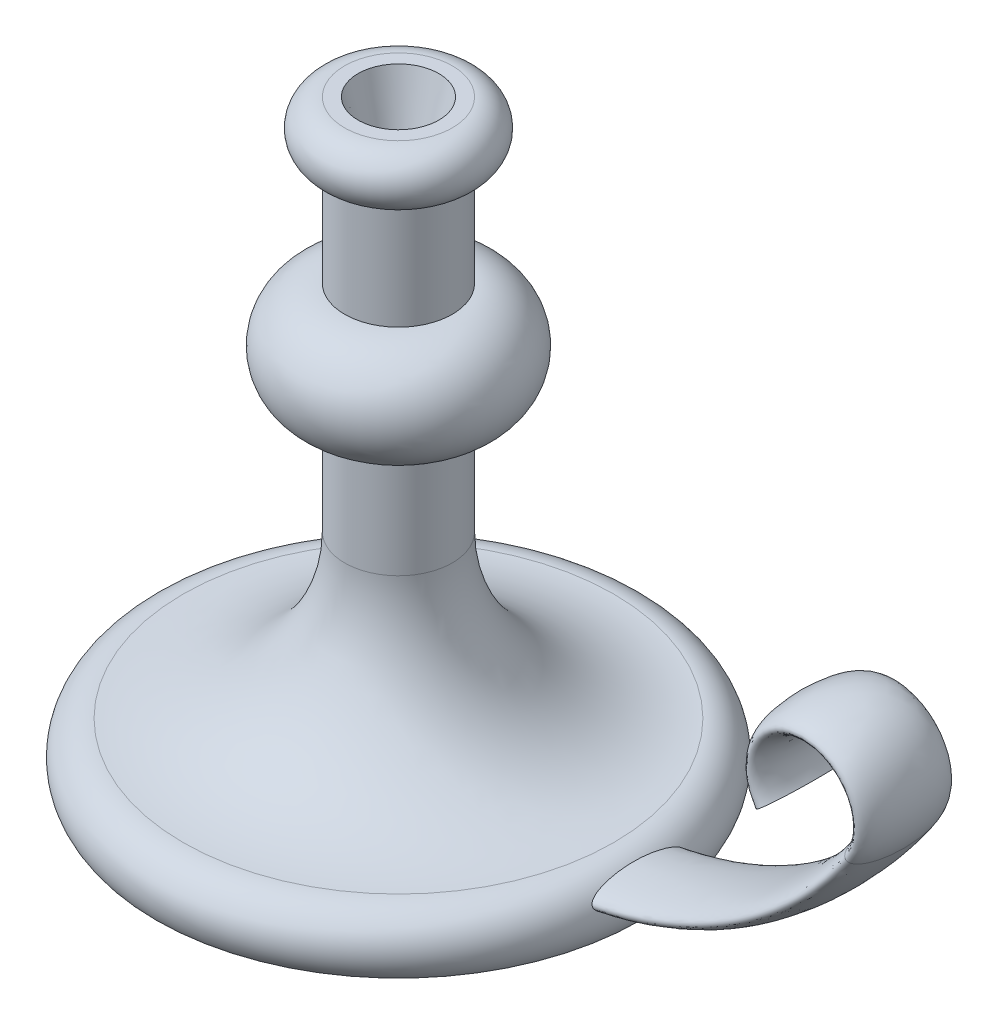
from build123d import *

# Parameters (mm, degrees)
SKETCH5_R          = 15
CUT_EXTRUDE1_DEPTH = 25
CUT_EXTRUDE1_DRAFT = -15
SKETCH7_RX         = 17.5
SKETCH7_RY         = 5


with BuildPart() as part:
    # Sketch1 → Revolve1 (revolve)
    with BuildSketch(Plane.XY, mode=Mode.PRIVATE) as revolve1_sk:
        with BuildLine():
            Line((0, 220), (0, 0))
            Line((0, 0), (90, 0))
            ThreePointArc((90, 0), (91.180339887, 13.090169944), (80, 20))
            ThreePointArc((80, 20), (37.573593129, 37.573593129), (20, 80))
            Line((20, 80), (20, 120))
            ThreePointArc((20, 120), (40, 140), (20, 160))
            Line((20, 160), (20, 200))
            ThreePointArc((20, 200), (30, 210), (20, 220))
            Line((20, 220), (0, 220))
        make_face()
    revolve(revolve1_sk.sketch.rotate(Axis((0, 220, 0), (0, -1, 0)), 180), axis=Axis((0, 220, 0), (0, -1, 0)))


with BuildPart() as cut_extrude1_tool:
    # Sketch5 → Cut-Extrude1 (with draft: the straight prism first)
    with BuildSketch(Plane(origin=(0, 220, 0), x_dir=(1, 0, 0), z_dir=(0, 1, 0))):
        Circle(SKETCH5_R)
    extrude(amount=-CUT_EXTRUDE1_DEPTH)
    # Cut-Extrude1: the draft: its side faces are tilted about the plane it starts from
    cut_extrude1_sides = [cut_extrude1_tool.faces().sort_by_distance(p)[0] for p in [
        (-15, 207.5, 0),
    ]]
    draft(cut_extrude1_sides, Plane(origin=(0, 220, 0), x_dir=(1, 0, 0), z_dir=(0, 1, 0)), CUT_EXTRUDE1_DRAFT)


with BuildPart() as part_1:
    add(part.part)

    # Cut-Extrude1: cut by cut_extrude1_tool
    add(cut_extrude1_tool.part, mode=Mode.SUBTRACT)

    # Sweep1: sweep along a path in Sketch2
    with BuildLine(Plane.XY) as sweep1_path:
        Line((0, 10), (60, 10))
        ThreePointArc((60, 10), (129.914780337, 27.23782575), (183.803497682, 75))
        ThreePointArc((183.803497682, 75), (167.340524295, 106.356518271), (150.877550907, 75))
    # Sketch7 → Sweep1 (sweep)
    with BuildSketch(Plane(origin=(0, 0, 0), x_dir=(0, 0, -1), z_dir=(1, 0, 0))):
        with Locations(Location((0, 10), (0, 0, 180))):
            Ellipse(SKETCH7_RX, SKETCH7_RY)
    sweep(path=sweep1_path.line)


solid = part_1.part
